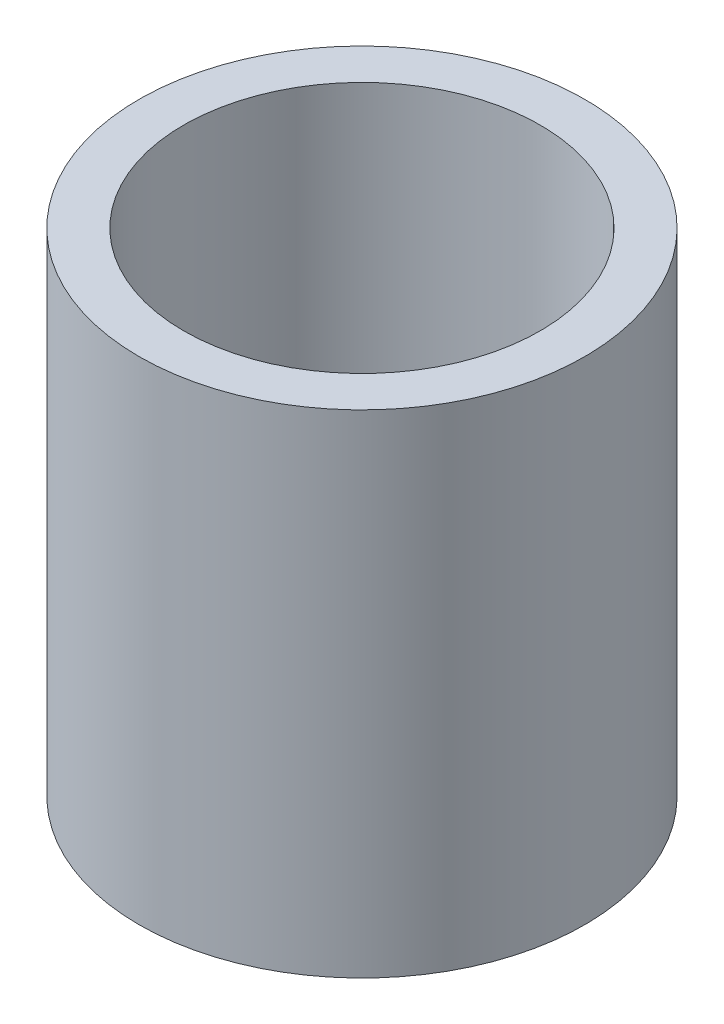
from build123d import *

# Parameters (mm, degrees)
SKETCH1_R           = 0.625
SKETCH1_R_2         = 0.5
BOSS_EXTRUDE1_DEPTH = 0.69


with BuildPart() as part:
    # Sketch1 → Boss-Extrude1 (new, symmetric)
    with BuildSketch(Plane(origin=(0, 0, 0), x_dir=(1, 0, 0), z_dir=(0, 1, 0))):
        with Locations(Location((0, 0, 0), (0, 0, 270))):
            Circle(SKETCH1_R)
        with Locations(Location((0, 0, 0), (0, 0, 270))):
            Circle(SKETCH1_R_2, mode=Mode.SUBTRACT)
    extrude(amount=BOSS_EXTRUDE1_DEPTH, both=True)


solid = part.part
